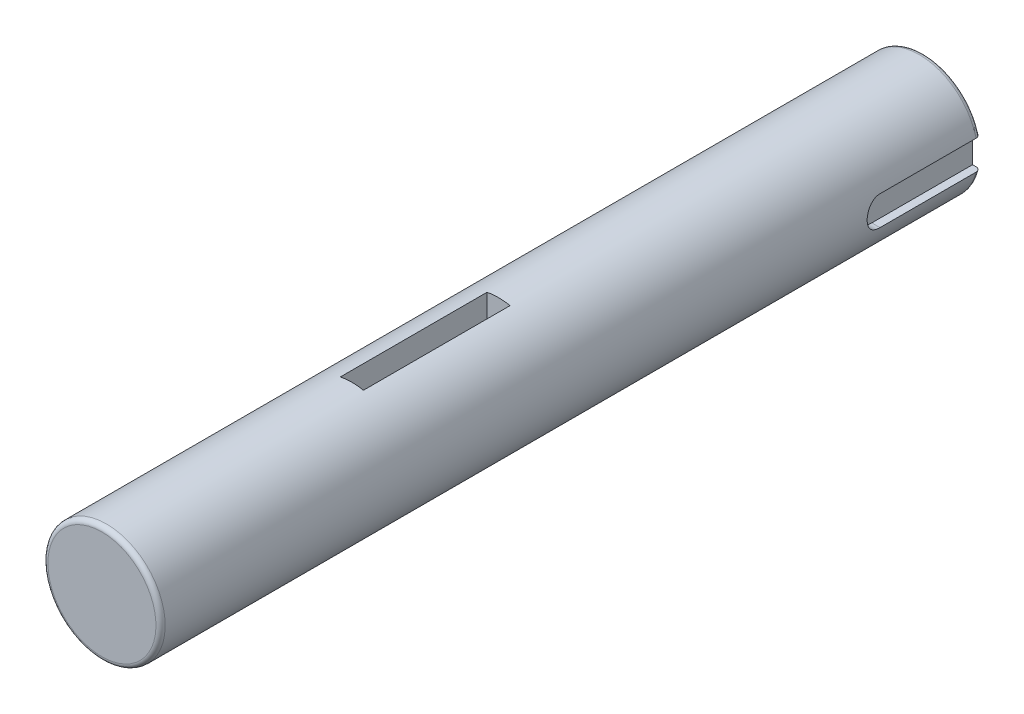
from build123d import *

# Parameters (mm, degrees)
CUT_EXTRUDE7_DEPTH = 4.35
CUT_EXTRUDE8_DEPTH = 63.5


with BuildPart() as part:
    # Sketch1 → Revolve1 (revolve)
    with BuildSketch(Plane(origin=(0, 0, 0), x_dir=(0, 0, -1), z_dir=(1, 0, 0))):
        with BuildLine():
            Line((0, 0), (0, 23.4))
            ThreePointArc((0, 23.4), (-0.585786438, 24.814213562), (-2, 25.4))
            Line((-2, 25.4), (-354, 25.4))
            ThreePointArc((-354, 25.4), (-355.414213562, 24.814213562), (-356, 23.4))
            Line((-356, 23.4), (-356, 0))
            Line((-356, 0), (0, 0))
        make_face()
    revolve(axis=Axis((0, 0, 0), (0, 0, 1)))

    # Sketch6 → Cut-Extrude7 (cut)
    with BuildSketch(Plane(origin=(25.4, 0, 0), x_dir=(0, 0, -1), z_dir=(1, 0, 0))):
        with BuildLine():
            Line((0, 6.35), (-43.65, 6.35))
            ThreePointArc((-43.65, 6.35), (-50, 0), (-43.65, -6.35))
            Line((-43.65, -6.35), (0, -6.35))
            Line((0, -6.35), (0, 6.35))
        make_face()
    extrude(amount=-CUT_EXTRUDE7_DEPTH, mode=Mode.SUBTRACT)

    # Sketch7 → Cut-Extrude8 (cut)
    with BuildSketch(Plane.XY.offset(247.75)):
        with BuildLine():
            Line((-5, 24.903011866), (-5, 14.903011866))
            Line((-5, 14.903011866), (5, 14.903011866))
            Line((5, 14.903011866), (5, 24.903011866))
            ThreePointArc((5, 24.903011866), (0, 25.4), (-5, 24.903011866))
        make_face()
    extrude(amount=-CUT_EXTRUDE8_DEPTH, mode=Mode.SUBTRACT)


solid = part.part
